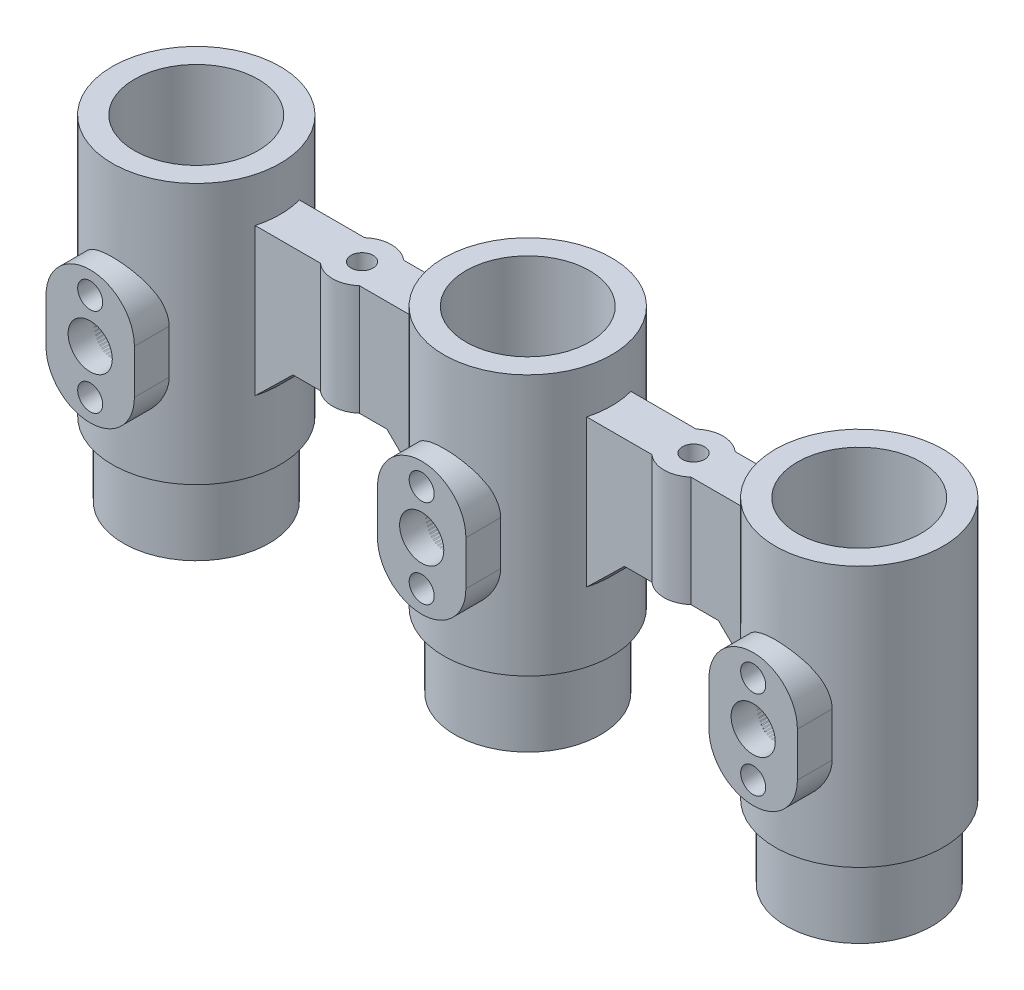
from build123d import *

# Parameters (mm, degrees)
SKETCH2_R           = 1.5
BOSS_EXTRUDE1_DEPTH = 15
SKETCH9_W           = 166.38618034
SKETCH9_H           = 90.507519626
CUT_EXTRUDE1_DEPTH  = 4
CHAMFER1_SIZE       = 5
SKETCH16_R          = 3
SKETCH16_R_2        = 1.7
BOSS_EXTRUDE9_DEPTH = 3
CUT_EXTRUDE7_DEPTH  = 10
LPATTERN11_COUNT    = 3
LPATTERN11_PITCH    = 45
LPATTERN11_2_COUNT  = 3
LPATTERN11_2_PITCH  = 45


with BuildPart() as part:
    # Sketch1 → Revolve2 (revolve)
    with BuildSketch(Plane.XY, mode=Mode.PRIVATE) as revolve2_sk:
        Polygon((9.9, 14.584681722), (11.4, 14.584681722), (11.4, 54), (8.4, 54), (8.4, 4.584681722), (9.9, 4.584681722), align=None)
    revolve(revolve2_sk.sketch.rotate(Axis((0, 51.150081367, 0), (0, -1, 0)), 180), axis=Axis((0, 51.150081367, 0), (0, -1, 0)))



with BuildPart() as body_2:
    # Sketch1<5> → Revolve3 (revolve)
    with BuildSketch(Plane.XY, mode=Mode.PRIVATE) as revolve3_sk:
        Polygon((-35.1, 14.584681722), (-33.6, 14.584681722), (-33.6, 54), (-36.6, 54), (-36.6, 4.584681722), (-35.1, 4.584681722), align=None)
    revolve(revolve3_sk.sketch.rotate(Axis((-45, 51.150081367, 0), (0, -1, 0)), 180), axis=Axis((-45, 51.150081367, 0), (0, -1, 0)))


with BuildPart() as body_3:
    # Sketch1<6> → Revolve4 (revolve)
    with BuildSketch(Plane.XY, mode=Mode.PRIVATE) as revolve4_sk:
        Polygon((56.4, 54), (53.4, 54), (53.4, 4.584681722), (54.9, 4.584681722), (54.9, 14.584681722), (56.4, 14.584681722), align=None)
    revolve(revolve4_sk.sketch.rotate(Axis((45, 51.150081367, 0), (0, -1, 0)), 180), axis=Axis((45, 51.150081367, 0), (0, -1, 0)))


with BuildPart() as part_1:
    add(part.part)

    add(body_2.part)  # Boss-Extrude1 merges body 2

    add(body_3.part)  # Boss-Extrude1 merges body 3
    # Sketch2 → Boss-Extrude1 (add)
    # profile 1 of 2: a face of its own
    with BuildSketch(Plane(origin=(0, 44, 0), x_dir=(1, 0, 0), z_dir=(0, 1, 0))):
        with BuildLine():
            Line((10.998181668, 3), (10.998181668, -3))
            Line((10.998181668, -3), (19.854248689, -3))
            ThreePointArc((19.854248689, -3), (22.5, -4), (25.145751311, -3))
            Line((25.145751311, -3), (34.001818332, -3))
            Line((34.001818332, -3), (34.001818332, 3))
            Line((34.001818332, 3), (25.145751311, 3))
            ThreePointArc((25.145751311, 3), (22.5, 4), (19.854248689, 3))
            Line((19.854248689, 3), (10.998181668, 3))
        make_face()
        with Locations(Location((22.5, 0, 0), (0, 0, 180))):
            Circle(SKETCH2_R, mode=Mode.SUBTRACT)
    # profile 2 of 2: a face of its own
    with BuildSketch(Plane(origin=(0, 44, 0), x_dir=(1, 0, 0), z_dir=(0, 1, 0))):
        with BuildLine():
            Line((-25.145751311, 3), (-34.001818332, 3))
            Line((-34.001818332, 3), (-34.001818332, -3))
            Line((-34.001818332, -3), (-25.145751311, -3))
            ThreePointArc((-25.145751311, -3), (-22.5, -4), (-19.854248689, -3))
            Line((-19.854248689, -3), (-10.998181668, -3))
            Line((-10.998181668, -3), (-10.998181668, 3))
            Line((-10.998181668, 3), (-19.854248689, 3))
            ThreePointArc((-19.854248689, 3), (-22.5, 4), (-25.145751311, 3))
        make_face()
        with Locations(Location((-22.5, 0, 0), (0, 0, 180))):
            Circle(SKETCH2_R, mode=Mode.SUBTRACT)
    extrude(amount=-BOSS_EXTRUDE1_DEPTH)

    # Sketch9 → Cut-Extrude1 (cut)
    with BuildSketch(Plane(origin=(0, 54, 0), x_dir=(1, 0, 0), z_dir=(0, 1, 0))):
        with Locations((1.025387307, -1.43554223)):
            Rectangle(SKETCH9_W, SKETCH9_H)
    extrude(amount=-CUT_EXTRUDE1_DEPTH, mode=Mode.SUBTRACT)

    # Chamfer1
    chamfer1_edges = [part_1.edges().sort_by_distance(p)[0] for p in [
        (11.4, 29, 0),
        (33.70090112, 29, 1.513395022),
        (-11.29909888, 29, -1.513395022),
        (-33.6, 29, 0),
    ]]
    chamfer(chamfer1_edges, length=CHAMFER1_SIZE)

    # Sketch16<8> → Cut-Extrude7 (cut)
    with BuildSketch(Plane.XY.offset(11.4)):
        with BuildLine():
            ThreePointArc((48, 30), (47.121320344, 32.121320344), (45, 33))
            Line((45, 33), (45, 27))
            ThreePointArc((45.000000007, 27), (47.121320346, 27.878679659), (48, 30))
        make_face()
        with BuildLine():
            Line((45, 27), (45, 33))
            ThreePointArc((45, 33), (42, 29.999999997), (45.000000007, 27))
        make_face()
        with BuildLine():
            ThreePointArc((46.7, 36), (46.202081528, 37.202081528), (45, 37.7))
            Line((45, 37.7), (45, 36))
            ThreePointArc((45, 36), (45.85, 35.93948651), (46.682854511, 35.759166667))
            ThreePointArc((46.682854511, 35.759166667), (46.69570821, 35.879278562), (46.7, 36))
        make_face()
        with BuildLine():
            Line((45, 36), (45, 37.7))
            ThreePointArc((45, 37.7), (43.715590278, 37.113683827), (43.317145489, 35.759166667))
            ThreePointArc((43.317145489, 35.759166667), (44.15, 35.93948651), (45, 36))
        make_face()
        with BuildLine():
            ThreePointArc((46.682854511, 35.759166667), (45.85, 35.93948651), (45, 36))
            Line((45, 36), (45, 34.3))
            ThreePointArc((45, 34.3), (46.113683827, 34.715590278), (46.682854511, 35.759166667))
        make_face()
        with BuildLine():
            Line((45, 34.3), (45, 36))
            ThreePointArc((45, 36), (44.15, 35.93948651), (43.317145489, 35.759166667))
            ThreePointArc((43.317145489, 35.759166667), (43.886316173, 34.715590278), (45, 34.3))
        make_face()
        with BuildLine():
            ThreePointArc((43.317145489, 24.240833333), (43.715590278, 22.886316173), (45, 22.3))
            Line((45, 22.3), (45, 24))
            ThreePointArc((45, 24), (44.15, 24.06051349), (43.317145489, 24.240833333))
        make_face()
        with BuildLine():
            Line((45, 24), (45, 22.3))
            ThreePointArc((45, 22.3), (46.202081528, 22.797918472), (46.7, 24))
            ThreePointArc((46.7, 24), (46.69570821, 24.120721438), (46.682854511, 24.240833333))
            ThreePointArc((46.682854511, 24.240833333), (45.85, 24.06051349), (45, 24))
        make_face()
        with BuildLine():
            ThreePointArc((46.682854511, 24.240833333), (46.113683827, 25.284409722), (45, 25.7))
            Line((45, 25.7), (45, 24))
            ThreePointArc((45, 24), (45.85, 24.06051349), (46.682854511, 24.240833333))
        make_face()
        with BuildLine():
            Line((45, 24), (45, 25.7))
            ThreePointArc((45, 25.7), (43.886316173, 25.284409722), (43.317145489, 24.240833333))
            ThreePointArc((43.317145489, 24.240833333), (44.15, 24.06051349), (45, 24))
        make_face()
    cut_extrude7 = extrude(amount=-CUT_EXTRUDE7_DEPTH, mode=Mode.SUBTRACT)

    # LPattern11 2: Cut-Extrude7 ×3
    with Locations(*[(-i * LPATTERN11_2_PITCH, 0, 0) for i in range(1, LPATTERN11_2_COUNT)]):
        add(cut_extrude7, mode=Mode.SUBTRACT)


with BuildPart() as body_2_2:
    # Sketch16 → Boss-Extrude9 (new, symmetric)
    with BuildSketch(Plane.XY.offset(11.4)):
        with BuildLine():
            Line((51, 27), (51, 33))
            ThreePointArc((51, 33), (45, 39), (39, 33))
            Line((39, 33), (39, 27))
            ThreePointArc((39, 27), (45, 21), (51, 27))
        make_face()
        with Locations((45, 30)):
            Circle(SKETCH16_R, mode=Mode.SUBTRACT)
        with Locations((45, 24)):
            Circle(SKETCH16_R_2, mode=Mode.SUBTRACT)
        with Locations((45, 36)):
            Circle(SKETCH16_R_2, mode=Mode.SUBTRACT)
    boss_extrude9 = extrude(amount=BOSS_EXTRUDE9_DEPTH, both=True)


with BuildPart() as lpattern11_1:
    # LPattern11: Boss-Extrude9 ×3
    with Locations(*[(-i * LPATTERN11_PITCH, 0, 0) for i in range(1, LPATTERN11_COUNT)]):
        add(boss_extrude9)


solid = Compound([part_1.part, body_2_2.part, lpattern11_1.part])
